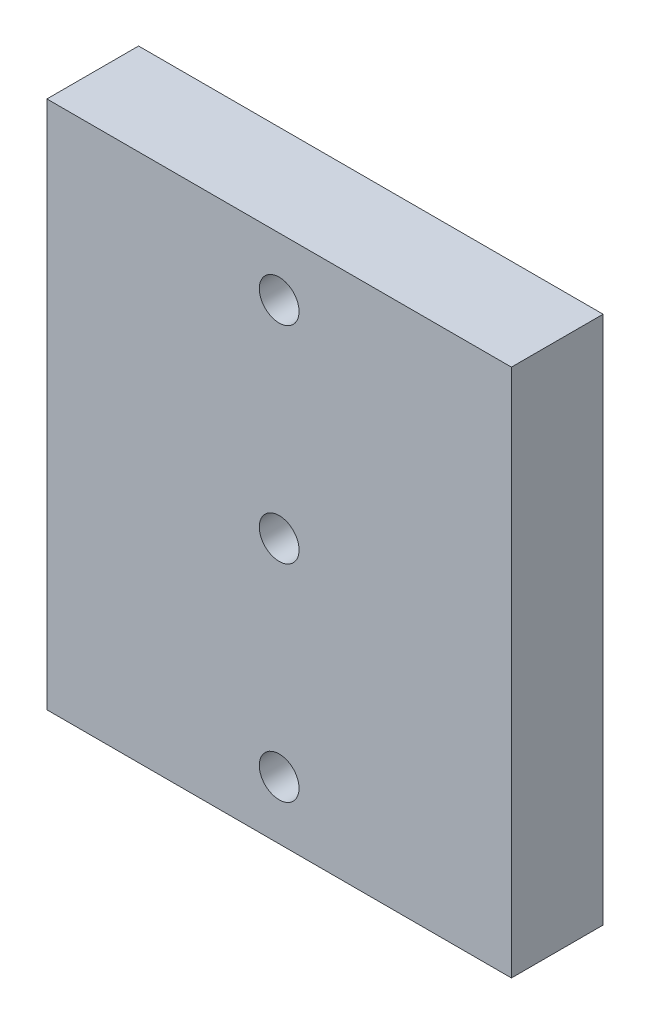
from build123d import *

# Parameters (mm, degrees)
SKETCH1_W                = 228.6
SKETCH1_H                = 260.35
BOSS_EXTRUDE1_DEPTH      = 45.1104
SKETCH2_R                = 6.5151
HAAS_T_SLOT_HOLES_DEPTH  = 180.011085727
SKETCH3_R                = 9.779
HAAS_COUNTER_BORES_DEPTH = 35.5854


with BuildPart() as part:
    # Sketch1 → Boss-Extrude1 (new body)
    with BuildSketch(Plane.XY):
        Rectangle(SKETCH1_W, SKETCH1_H)
    extrude(amount=BOSS_EXTRUDE1_DEPTH)

    # Sketch2 → HAAS T-Slot Holes (cut, through all)
    with BuildSketch(Plane.XY.offset(45.1104)):
        Circle(SKETCH2_R)
        with Locations((0, 101.6)):
            Circle(SKETCH2_R)
        with Locations((0, -101.6)):
            Circle(SKETCH2_R)
    extrude(amount=-HAAS_T_SLOT_HOLES_DEPTH, mode=Mode.SUBTRACT)

    # Sketch3 → HAAS Counter Bores (cut)
    with BuildSketch(Plane.XY.offset(45.1104)):
        with Locations((0, 101.6)):
            Circle(SKETCH3_R)
        Circle(SKETCH3_R)
        with Locations((0, -101.6)):
            Circle(SKETCH3_R)
    extrude(amount=-HAAS_COUNTER_BORES_DEPTH, mode=Mode.SUBTRACT)


solid = part.part
